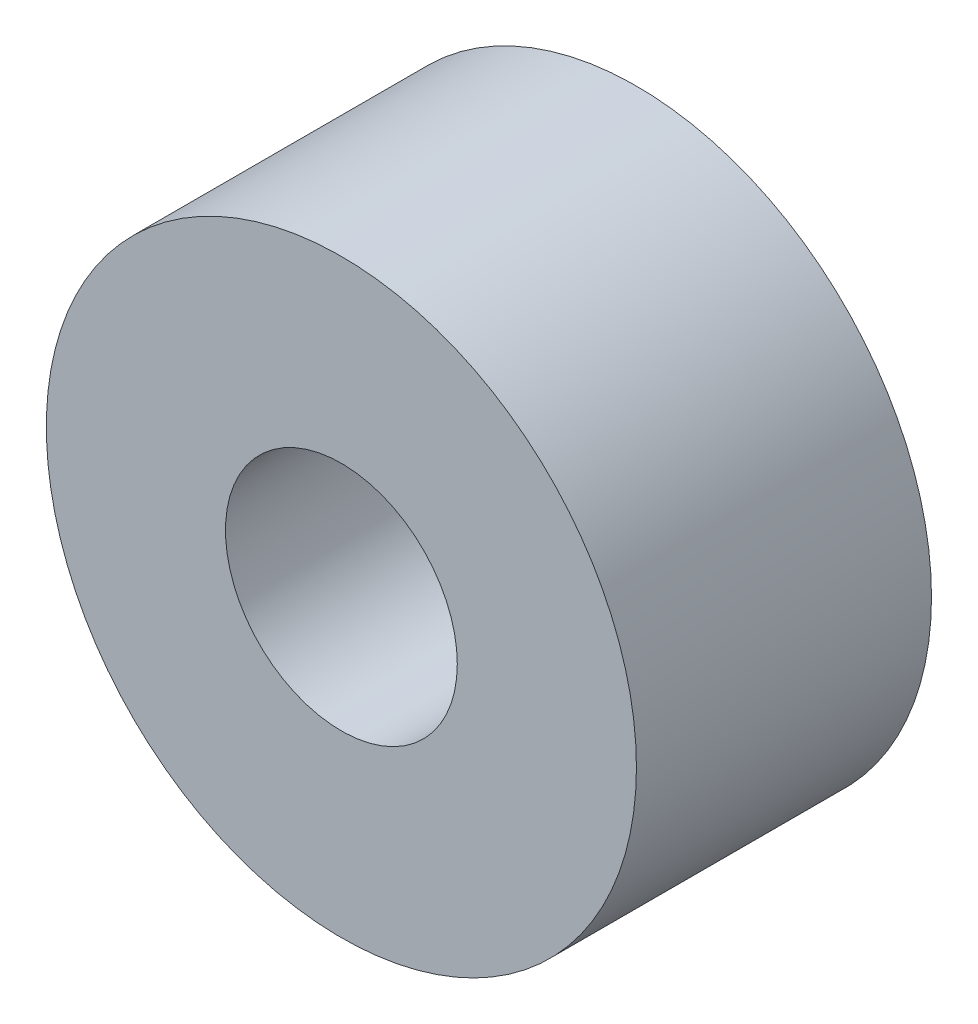
from build123d import *

# Parameters (mm, degrees)
SKETCH1_R           = 14
SKETCH1_R_2         = 5.5
BOSS_EXTRUDE1_DEPTH = 14


with BuildPart() as part:
    # Sketch1 → Boss-Extrude1 (new body)
    with BuildSketch(Plane.XY):
        Circle(SKETCH1_R)
        Circle(SKETCH1_R_2, mode=Mode.SUBTRACT)
    extrude(amount=BOSS_EXTRUDE1_DEPTH)


solid = part.part
